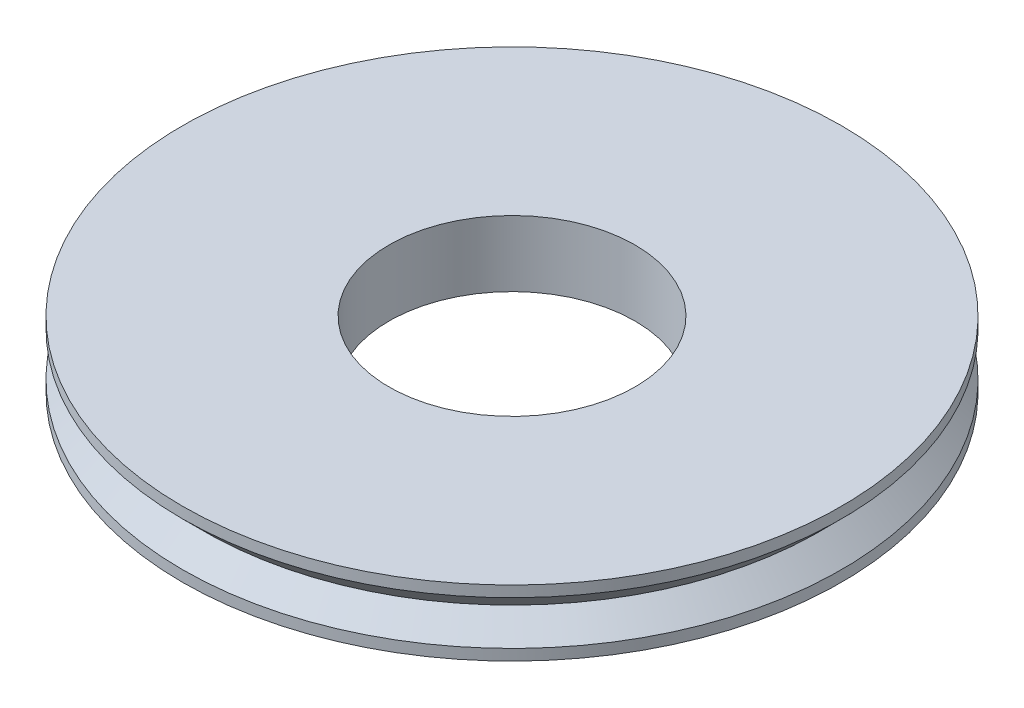
from build123d import *


with BuildPart() as part:
    # Sketch1 → Revolve1 (revolve)
    with BuildSketch(Plane.XY, mode=Mode.PRIVATE) as revolve1_sk:
        Polygon((-5.6, 0), (-5.6, 3), (-15, 3), (-15, 2.5), (-14, 1.5), (-15, 0.5), (-15, 0), align=None)
    revolve(revolve1_sk.sketch.rotate(Axis((0, 0, 0), (0, 1, 0)), 270), axis=Axis((0, 0, 0), (0, 1, 0)))


solid = part.part
